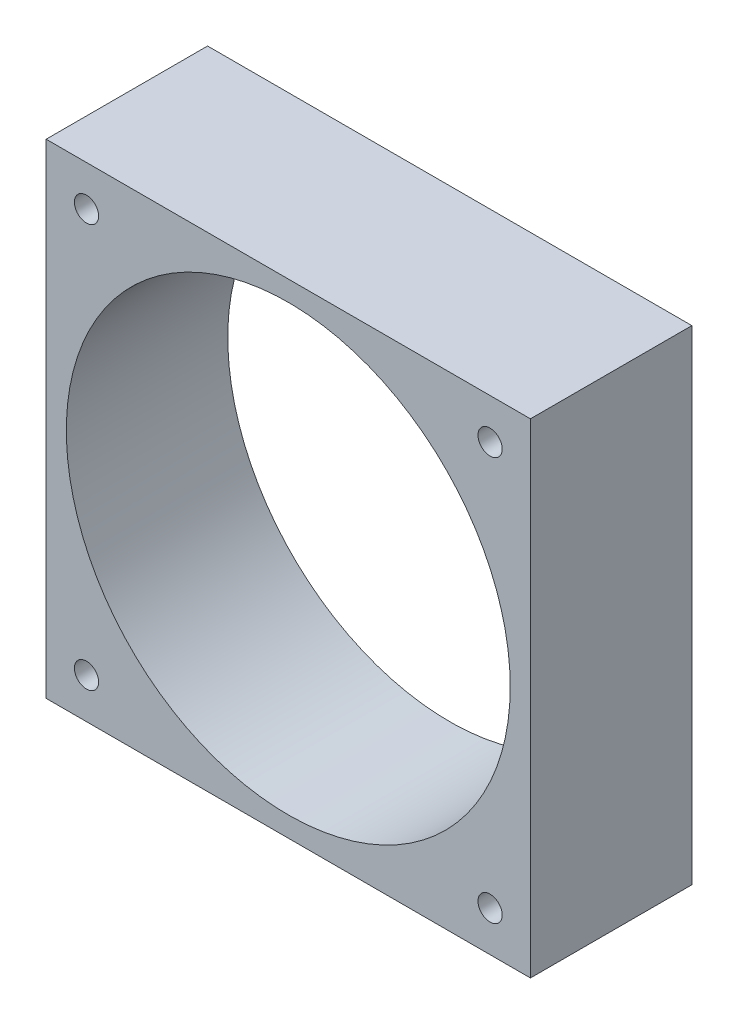
from build123d import *

# Parameters (mm, degrees)
ESBO_O1_W                = 60
ESBO_O1_H                = 60
ESBO_O1_R                = 1.5
ESBO_O1_R_2              = 27.5
RESSALTO_EXTRUS_O1_DEPTH = 20


with BuildPart() as part:
    # Esboço1 → Ressalto-extrusão1 (new body)
    with BuildSketch(Plane.XY):
        Rectangle(ESBO_O1_W, ESBO_O1_H)
        with Locations((25, 25)):
            Circle(ESBO_O1_R, mode=Mode.SUBTRACT)
        with Locations((-25, 25)):
            Circle(ESBO_O1_R, mode=Mode.SUBTRACT)
        with Locations((-25, -25)):
            Circle(ESBO_O1_R, mode=Mode.SUBTRACT)
        with Locations((25, -25)):
            Circle(ESBO_O1_R, mode=Mode.SUBTRACT)
        Circle(ESBO_O1_R_2, mode=Mode.SUBTRACT)
    extrude(amount=RESSALTO_EXTRUS_O1_DEPTH)


solid = part.part
